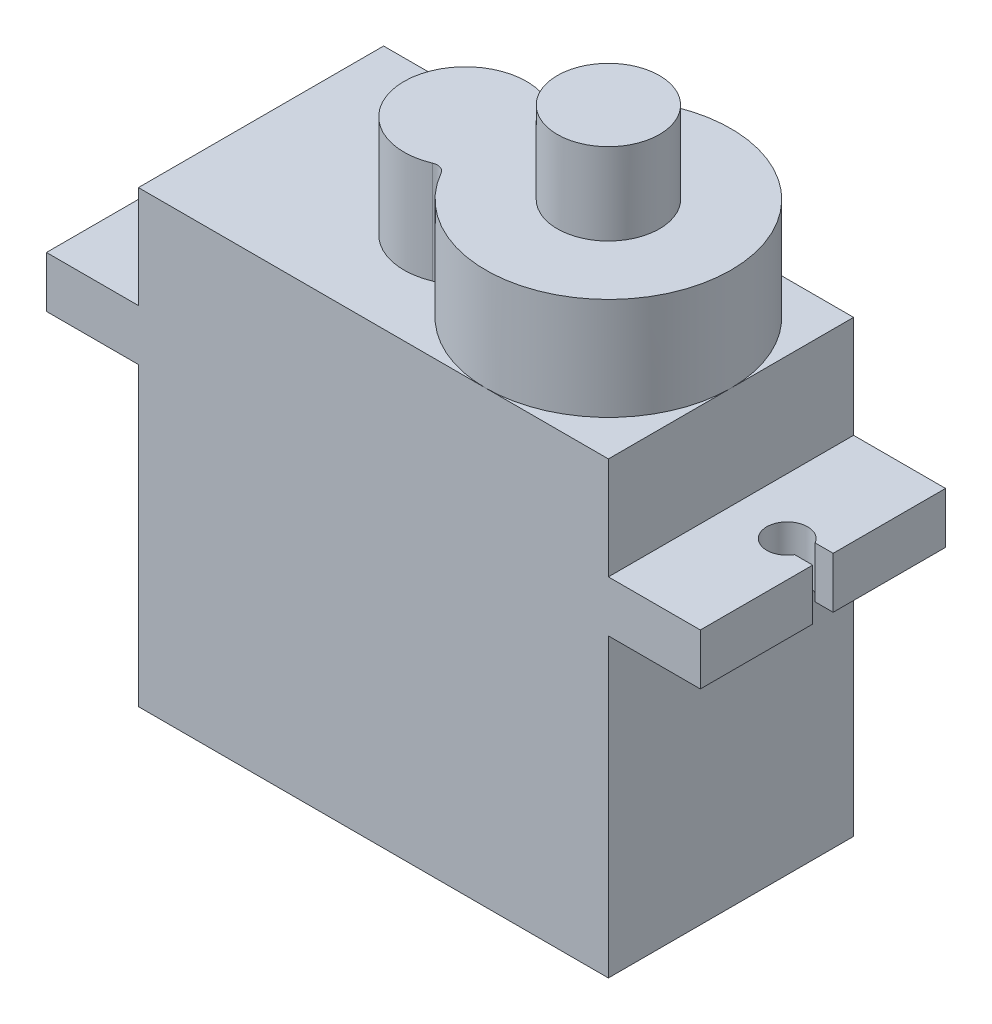
from build123d import *

# Parameters (mm, degrees)
SKETCH_1_W          = 23
SKETCH_1_H          = 12
EXTRUDE_1_DEPTH     = 22
SKETCH_2_W          = 32
SKETCH_2_H          = 12
EXTRUDE_2_DEPTH     = 2.5
CUT_EXTRUDE_1_DEPTH = 25.103941586
EXTRUDE_3_DEPTH     = 5
SKETCH_5_R          = 2.5
EXTRUDE_4_DEPTH     = 4


with BuildPart() as part:
    # 草图1 → 凸台-拉伸1 (new body)
    with BuildSketch(Plane(origin=(0, 0, 0), x_dir=(1, 0, 0), z_dir=(0, 1, 0))):
        Rectangle(SKETCH_1_W, SKETCH_1_H)
    extrude(amount=EXTRUDE_1_DEPTH)

    # 草图2 → 凸台-拉伸2 (add)
    with BuildSketch(Plane(origin=(0, 17, 0), x_dir=(1, 0, 0), z_dir=(0, 1, 0))):
        Rectangle(SKETCH_2_W, SKETCH_2_H)
    extrude(amount=-EXTRUDE_2_DEPTH)

    # 草图3 → 切除-拉伸1 (cut, through all)
    with BuildSketch(Plane(origin=(0, 17, 0), x_dir=(1, 0, 0), z_dir=(0, 1, 0))):
        with BuildLine():
            Line((-16, 0.5), (-15.116025404, 0.5))
            ThreePointArc((-15.116025404, 0.5), (-13.25, 0), (-15.116025404, -0.5))
            Line((-15.116025404, -0.5), (-16, -0.5))
            Line((-16, -0.5), (-16, 0.5))
        make_face()
    cut_extrude_1 = extrude(amount=-CUT_EXTRUDE_1_DEPTH, mode=Mode.SUBTRACT)

    # 镜向1: 切除-拉伸1 across plane
    add(cut_extrude_1.mirror(Plane(origin=(0, 0, 0), x_dir=(0, 0, 1), z_dir=(1, 0, 0))), mode=Mode.SUBTRACT)

    # 草图4 → 凸台-拉伸3 (add)
    with BuildSketch(Plane(origin=(0, 22, 0), x_dir=(1, 0, 0), z_dir=(0, 1, 0))):
        with BuildLine():
            ThreePointArc((0.291208791, -2.978001703), (11.5, 0), (0.291208791, 2.978001703))
            ThreePointArc((0.291208791, 2.978001703), (0.017562524, 2.752601694), (-0.336734694, 2.765287296))
            ThreePointArc((-0.336734694, 2.765287296), (-4.5, 0), (-0.336734694, -2.765287296))
            ThreePointArc((-0.336734694, -2.765287296), (0.017562524, -2.752601694), (0.291208791, -2.978001703))
        make_face()
    extrude(amount=EXTRUDE_3_DEPTH)

    # 草图5 → 凸台-拉伸4 (add)
    with BuildSketch(Plane(origin=(0, 27, 0), x_dir=(1, 0, 0), z_dir=(0, 1, 0))):
        with Locations(Location((5.5, 0, 0), (0, 0, 90))):
            Circle(SKETCH_5_R)
    extrude(amount=EXTRUDE_4_DEPTH)


solid = part.part
